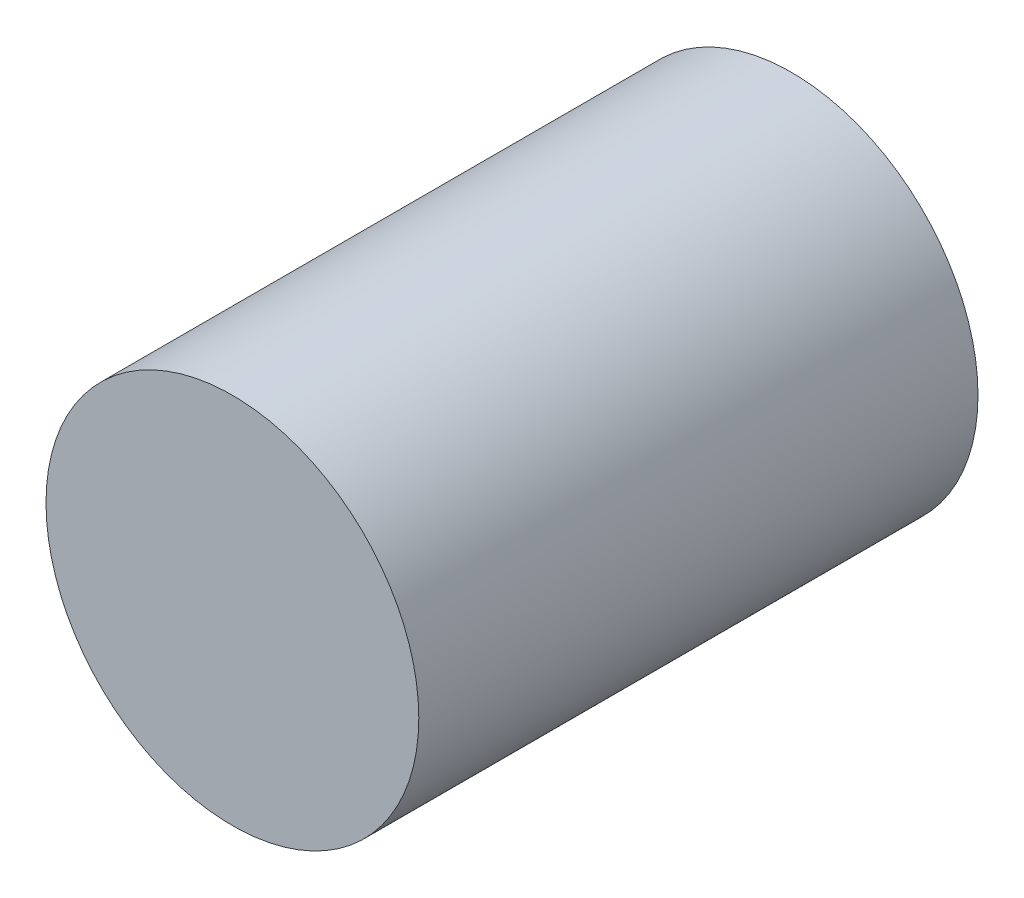
from build123d import *

# Parameters (mm, degrees)
SKETCH1_R           = 6.35
BOSS_EXTRUDE1_DEPTH = 19.05


with BuildPart() as part:
    # Sketch1 → Boss-Extrude1 (new body)
    with BuildSketch(Plane.XY):
        with Locations(Location((0, 0, 0), (0, 0, 180))):
            Circle(SKETCH1_R)
    extrude(amount=BOSS_EXTRUDE1_DEPTH)


solid = part.part
